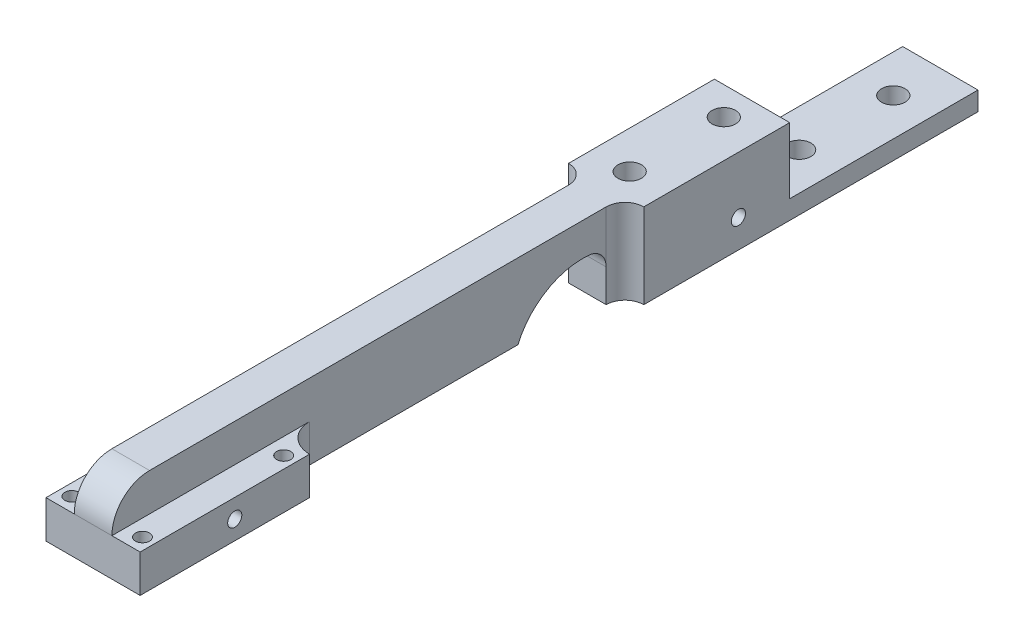
from build123d import *

# Parameters (mm, degrees)
SKETCH1_W           = 20
SKETCH1_H           = 8
BOSS_EXTRUDE1_DEPTH = 140
CUT_EXTRUDE1_DEPTH  = 141.584494166
BOSS_EXTRUDE2_DEPTH = 4
CUT_EXTRUDE2_DEPTH  = 142.393069137
BOSS_EXTRUDE3_DEPTH = 18
SKETCH7_W           = 16
SKETCH7_H           = 4
BOSS_EXTRUDE4_DEPTH = 40
SKETCH8_R           = 1.5
CUT_EXTRUDE3_DEPTH  = 141.712472795
SKETCH9_W           = 15
SKETCH9_H           = 30
CUT_EXTRUDE4_DEPTH  = 1.5
CUT_EXTRUDE5_DEPTH  = 2
SKETCH11_R          = 2.5
CUT_EXTRUDE6_DEPTH  = 142.50618361
SKETCH12_R          = 2.5
CUT_EXTRUDE7_DEPTH  = 142.05318146
SKETCH13_R          = 1.5
CUT_EXTRUDE8_DEPTH  = 15
SKETCH14_R          = 1.5
CUT_EXTRUDE9_DEPTH  = 15


with BuildPart() as part:
    # Sketch1 → Boss-Extrude1 (new body)
    with BuildSketch(Plane.XY):
        with Locations((0, 2)):
            Rectangle(SKETCH1_W, SKETCH1_H)
    extrude(amount=BOSS_EXTRUDE1_DEPTH)

    # Sketch2 → Cut-Extrude1 (cut, through all)
    with BuildSketch(Plane(origin=(0, 6, 0), x_dir=(1, 0, 0), z_dir=(0, 1, 0))):
        with BuildLine():
            Line((-10, 0), (-4, 0))
            Line((-4, 0), (-4, -98))
            ThreePointArc((-4, -98), (-5.757359313, -102.242640687), (-10, -104))
            Line((-10, -104), (-10, 0))
        make_face()
        with BuildLine():
            Line((10, -104), (10, 0))
            Line((10, 0), (4, 0))
            Line((4, 0), (4, -98))
            ThreePointArc((4, -98), (5.757359313, -102.242640687), (10, -104))
        make_face()
    extrude(amount=-CUT_EXTRUDE1_DEPTH, mode=Mode.SUBTRACT)

    # Sketch3 → Boss-Extrude2 (add, symmetric)
    with BuildSketch(Plane(origin=(0, 0, 0), x_dir=(0, 0, -1), z_dir=(1, 0, 0))):
        with BuildLine():
            Line((-140, 6), (0, 6))
            Line((0, 6), (0, 14))
            Line((0, 14), (-132, 14))
            ThreePointArc((-132, 14), (-137.656854249, 11.656854249), (-140, 6))
        make_face()
    extrude(amount=BOSS_EXTRUDE2_DEPTH, both=True)

    # Sketch4 → Cut-Extrude2 (cut, through all)
    with BuildSketch(Plane(origin=(4, 0, 0), x_dir=(0, 0, -1), z_dir=(1, 0, 0))):
        with BuildLine():
            Line((-35, -2), (-35, 2.95445115))
            ThreePointArc((-35, 2.95445115), (-36.045804216, 5.6512506), (-38.636363636, 6.937887932))
            ThreePointArc((-38.636363636, 6.937887932), (-47.636287443, 4.910736388), (-53.747727085, -2))
            Line((-53.747727085, -2), (-35, -2))
        make_face()
    extrude(amount=-CUT_EXTRUDE2_DEPTH, mode=Mode.SUBTRACT)

    # Sketch6 → Boss-Extrude3 (add)
    with BuildSketch(Plane(origin=(0, 14, 0), x_dir=(1, 0, 0), z_dir=(0, 1, 0))):
        with BuildLine():
            Line((-4, 0), (-8, 0))
            Line((-8, 0), (-8, -31))
            ThreePointArc((-8, -31), (-5.171572875, -32.171572875), (-4, -35))
            Line((-4, -35), (4, -35))
            ThreePointArc((4, -35), (5.171572875, -32.171572875), (8, -31))
            Line((8, -31), (8, 0))
            Line((8, 0), (4, 0))
            Line((4, 0), (-4, 0))
        make_face()
    extrude(amount=-BOSS_EXTRUDE3_DEPTH)

    # Sketch7 → Boss-Extrude4 (add)
    with BuildSketch(Plane(origin=(0, 0, 0), x_dir=(-1, 0, 0), z_dir=(0, 0, -1))):
        with Locations((0, -2)):
            Rectangle(SKETCH7_W, SKETCH7_H)
    extrude(amount=BOSS_EXTRUDE4_DEPTH)

    # Sketch8 → Cut-Extrude3 (cut, through all)
    with BuildSketch(Plane(origin=(0, 6, 0), x_dir=(1, 0, 0), z_dir=(0, 1, 0))):
        with Locations(Location((7.5, -137, 0), (0, 0, 270))):
            Circle(SKETCH8_R)
        with Locations(Location((7.5, -107, 0), (0, 0, 270))):
            Circle(SKETCH8_R)
        with Locations(Location((-7.5, -107, 0), (0, 0, 180))):
            Circle(SKETCH8_R)
        with Locations(Location((-7.5, -137, 0), (0, 0, 180))):
            Circle(SKETCH8_R)
    extrude(amount=-CUT_EXTRUDE3_DEPTH, mode=Mode.SUBTRACT)

    # Sketch9 → Cut-Extrude4 (cut)
    with BuildSketch(Plane.XZ.offset(2)):
        with Locations((0, 122)):
            Rectangle(SKETCH9_W, SKETCH9_H)
    extrude(amount=-CUT_EXTRUDE4_DEPTH, mode=Mode.SUBTRACT)

    # Sketch10 → Cut-Extrude5 (cut)
    with BuildSketch(Plane.XZ.offset(2)):
        with BuildLine():
            Line((3, 79), (3, 65))
            ThreePointArc((3, 65), (0, 62), (-3, 65))
            Line((-3, 65), (-3, 79))
            ThreePointArc((-3, 79), (0, 82), (3, 79))
        make_face()
    extrude(amount=-CUT_EXTRUDE5_DEPTH, mode=Mode.SUBTRACT)

    # Sketch11 → Cut-Extrude6 (cut, through all)
    with BuildSketch(Plane(origin=(0, 14, 0), x_dir=(1, 0, 0), z_dir=(0, 1, 0))):
        with Locations(Location((0, -26, 0), (0, 0, 270))):
            Circle(SKETCH11_R)
        with Locations(Location((0, -6, 0), (0, 0, 270))):
            Circle(SKETCH11_R)
    extrude(amount=-CUT_EXTRUDE6_DEPTH, mode=Mode.SUBTRACT)

    # Sketch12 → Cut-Extrude7 (cut, through all)
    with BuildSketch(Plane(origin=(0, 0, 0), x_dir=(1, 0, 0), z_dir=(0, 1, 0))):
        with Locations(Location((0, 10, 0), (0, 0, 270))):
            Circle(SKETCH12_R)
        with Locations(Location((0, 30, 0), (0, 0, 270))):
            Circle(SKETCH12_R)
    extrude(amount=-CUT_EXTRUDE7_DEPTH, mode=Mode.SUBTRACT)

    # Sketch13 → Cut-Extrude8 (cut)
    with BuildSketch(Plane(origin=(10, 0, 0), x_dir=(0, 0, -1), z_dir=(1, 0, 0))):
        with Locations((-119.9, 2)):
            Circle(SKETCH13_R)
    extrude(amount=-CUT_EXTRUDE8_DEPTH, mode=Mode.SUBTRACT)

    # Sketch14 → Cut-Extrude9 (cut)
    with BuildSketch(Plane(origin=(8, 0, 0), x_dir=(0, 0, -1), z_dir=(1, 0, 0))):
        with Locations((-10.9, 2)):
            Circle(SKETCH14_R)
    extrude(amount=-CUT_EXTRUDE9_DEPTH, mode=Mode.SUBTRACT)


solid = part.part
